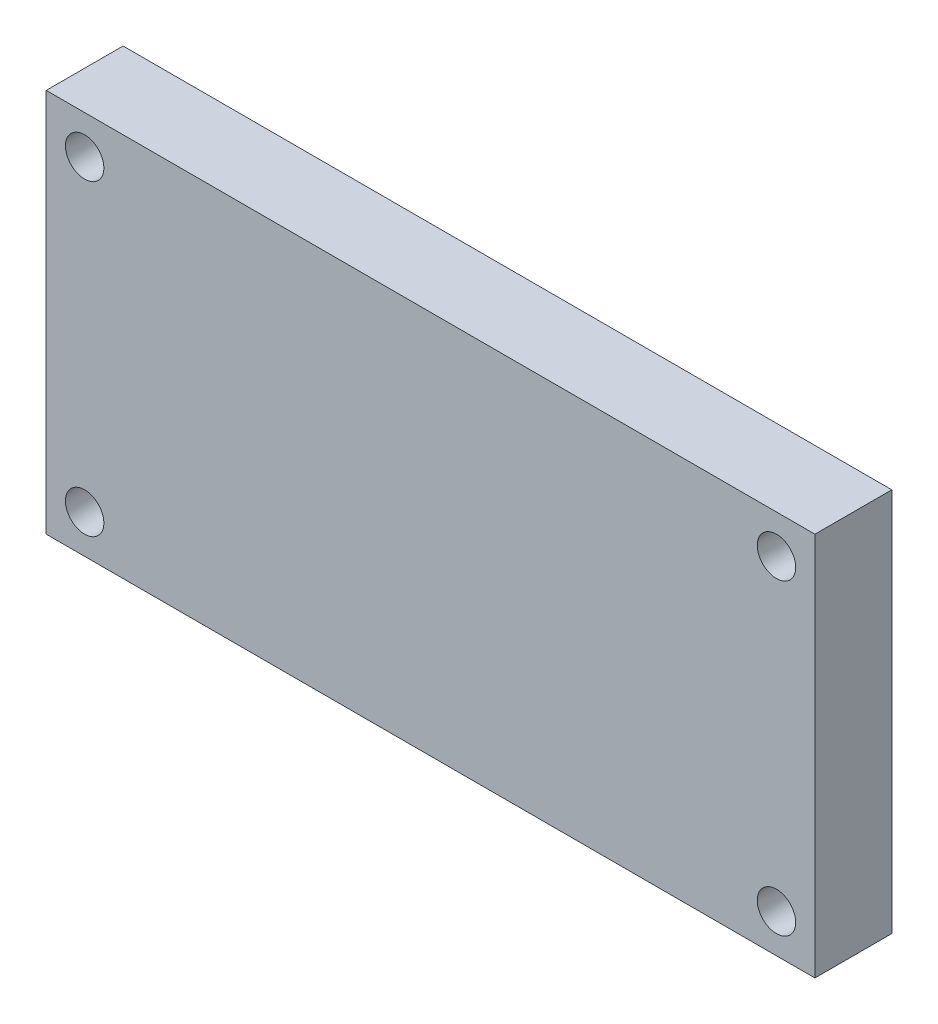
from build123d import *

# Parameters (mm, degrees)
SKETCH1_W           = 100
SKETCH1_H           = 50
SKETCH1_R           = 2.5
BOSS_EXTRUDE1_DEPTH = 5
SKETCH2_W           = 20
SKETCH2_H           = 10
SKETCH2_W_2         = 8.5
SKETCH2_H_2         = 8
BOSS_EXTRUDE2_DEPTH = 2
SKETCH2_3_W         = 8.5
SKETCH2_3_H         = 8
BOSS_EXTRUDE3_DEPTH = 3


with BuildPart() as part:
    # Sketch1 → Boss-Extrude1 (new, symmetric)
    with BuildSketch(Plane.XY):
        with Locations((50, 25)):
            Rectangle(SKETCH1_W, SKETCH1_H)
        with Locations((5, 5)):
            Circle(SKETCH1_R, mode=Mode.SUBTRACT)
        with Locations((5, 45)):
            Circle(SKETCH1_R, mode=Mode.SUBTRACT)
        with Locations((95, 45)):
            Circle(SKETCH1_R, mode=Mode.SUBTRACT)
        with Locations((95, 5)):
            Circle(SKETCH1_R, mode=Mode.SUBTRACT)
    extrude(amount=BOSS_EXTRUDE1_DEPTH, both=True)

    # Sketch2 → Boss-Extrude2 (add)
    with BuildSketch(Plane(origin=(0, 0, -5), x_dir=(-1, 0, 0), z_dir=(0, 0, -1))):
        with Locations((-50, 25)):
            Rectangle(SKETCH2_W, SKETCH2_H)
        with Locations((-54.75, 25)):
            Rectangle(SKETCH2_W_2, SKETCH2_H_2, mode=Mode.SUBTRACT)
        with Locations((-45.25, 25)):
            Rectangle(SKETCH2_W_2, SKETCH2_H_2, mode=Mode.SUBTRACT)
    extrude(amount=BOSS_EXTRUDE2_DEPTH)

    # Sketch2<3> → Boss-Extrude3 (add)
    with BuildSketch(Plane(origin=(0, 0, -5), x_dir=(-1, 0, 0), z_dir=(0, 0, -1))):
        with Locations((-54.75, 25)):
            Rectangle(SKETCH2_3_W, SKETCH2_3_H)
        with Locations((-45.25, 25)):
            Rectangle(SKETCH2_3_W, SKETCH2_3_H)
    extrude(amount=BOSS_EXTRUDE3_DEPTH)


solid = part.part
